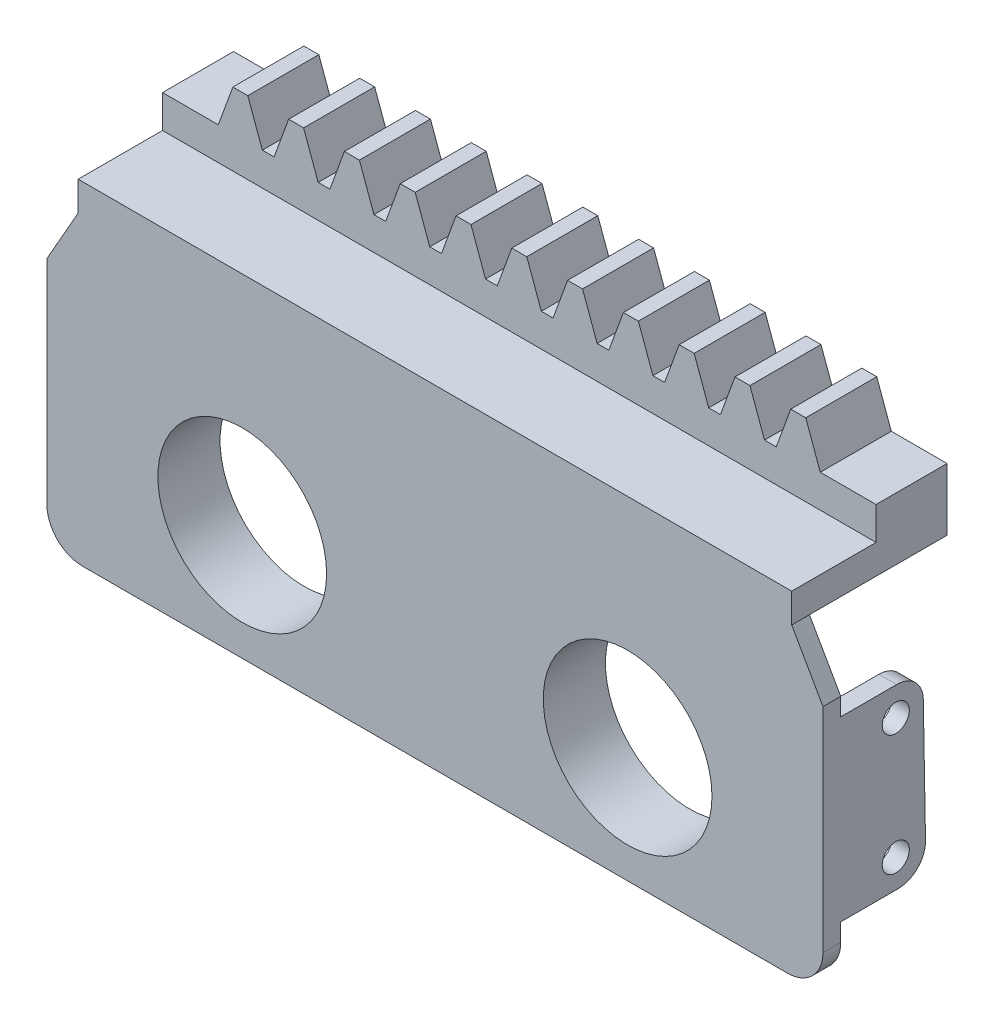
from build123d import *

# Parameters (mm, degrees)
SKETCH1_W           = 213.628300444
SKETCH1_H           = 8
EXTRUDE1_DEPTH      = 8
EXTRUDE2_DEPTH      = 8
LPATTERN1_COUNT     = 34
LPATTERN1_PITCH     = 6.283185307
SKETCH_1_W          = 133.268632933
SKETCH_1_H          = 8
CUT_EXTRUDE_1_DEPTH = 25
SKETCH_2_W          = 4.961443825
SKETCH_2_H          = 8
CUT_EXTRUDE_2_DEPTH = 50
SKETCH_3_W          = 80.359667511
SKETCH_3_H          = 1
CUT_EXTRUDE_3_DEPTH = 50
SKETCH_4_W          = 80.359667511
SKETCH_4_H          = 9.5
EXTRUDE_1_DEPTH     = 3.3
SKETCH_5_R          = 10.5
SKETCH_5_R_2        = 9.5
EXTRUDE_2_DEPTH     = 7
EXTRUDE_2_2_DEPTH   = 7
SKETCH_6_R          = 10.5
EXTRUDE_3_DEPTH     = 2
EXTRUDE_4_DEPTH     = 2
SKETCH_8_R          = 1.525
CUT_EXTRUDE_4_DEPTH = 2
FILLET_1_R          = 4


with BuildPart() as part:
    # Sketch1 → Extrude1 (new body)
    with BuildSketch(Plane.XY):
        with Locations((106.814150222, -4)):
            Rectangle(SKETCH1_W, SKETCH1_H)
    extrude(amount=EXTRUDE1_DEPTH)

    # Sketch2 → Extrude2 (add)
    with BuildSketch(Plane.XY.offset(8)):
        Polygon((0, 0), (1.637866054, 4.5), (3.323577771, 4.5), (4.961443825, 0), align=None)
    extrude2 = extrude(amount=-EXTRUDE2_DEPTH)

    # LPattern1: Extrude2 ×34
    with Locations(*[(i * LPATTERN1_PITCH, 0, 0) for i in range(1, LPATTERN1_COUNT)]):
        add(extrude2)

    # 草图1 → 切除-拉伸1 (cut, symmetric)
    with BuildSketch(Plane(origin=(0, 0, 0), x_dir=(1, 0, 0), z_dir=(0, 1, 0))):
        with Locations((146.993983978, -4)):
            Rectangle(SKETCH_1_W, SKETCH_1_H)
    extrude(amount=CUT_EXTRUDE_1_DEPTH, both=True, mode=Mode.SUBTRACT)

    # 草图2 → 切除-拉伸2 (cut)
    with BuildSketch(Plane(origin=(0, 0, 0), x_dir=(1, 0, 0), z_dir=(0, 1, 0))):
        with Locations((77.878945599, -4)):
            Rectangle(SKETCH_2_W, SKETCH_2_H)
        with Locations((2.480721912, -4)):
            Rectangle(SKETCH_2_W, SKETCH_2_H)
    extrude(amount=CUT_EXTRUDE_2_DEPTH, mode=Mode.SUBTRACT)

    # 草图3 → 切除-拉伸3 (cut)
    with BuildSketch(Plane(origin=(0, 0, 0), x_dir=(-1, 0, 0), z_dir=(0, 0, -1))):
        with Locations((-40.179833756, -7.5)):
            Rectangle(SKETCH_3_W, SKETCH_3_H)
    extrude(amount=-CUT_EXTRUDE_3_DEPTH, mode=Mode.SUBTRACT)

    # 草图4 → 凸台-拉伸1 (add)
    with BuildSketch(Plane.XZ.offset(7)):
        with Locations((40.179833756, 12.75)):
            Rectangle(SKETCH_4_W, SKETCH_4_H)
    extrude(amount=-EXTRUDE_1_DEPTH)



with BuildPart() as body_2:
    # 草图5 → 凸台-拉伸2 (new body)
    with BuildSketch(Plane.XY.offset(17.5)):
        with Locations((61.879833756, -28.2)):
            Circle(SKETCH_5_R)
        with Locations((61.879833756, -28.2)):
            Circle(SKETCH_5_R_2, mode=Mode.SUBTRACT)
    extrude(amount=-EXTRUDE_2_DEPTH)


with BuildPart() as body_3:
    # 草图5 → Extrude 2 2 (new body)
    with BuildSketch(Plane.XY.offset(17.5)):
        with Locations((18.479833756, -28.2)):
            Circle(SKETCH_5_R)
        with Locations((18.479833756, -28.2)):
            Circle(SKETCH_5_R_2, mode=Mode.SUBTRACT)
    extrude(amount=-EXTRUDE_2_2_DEPTH)


with BuildPart() as part_1:
    add(part.part)

    add(body_2.part)  # 凸台-拉伸3 merges body 2

    add(body_3.part)  # 凸台-拉伸3 merges body 3
    # 草图6 → 凸台-拉伸3 (add)
    with BuildSketch(Plane.XY.offset(17.5)):
        Polygon((-3.520166244, -41.2), (83.879833756, -41.2), (83.879833756, -13.2), (80.359667511, -7), (0, -7), (-3.520166244, -13.2), align=None)
        with Locations((61.879833756, -28.2)):
            Circle(SKETCH_6_R, mode=Mode.SUBTRACT)
        with Locations((18.479833756, -28.2)):
            Circle(SKETCH_6_R, mode=Mode.SUBTRACT)
    extrude(amount=-EXTRUDE_3_DEPTH)

    # 草图7 → 凸台-拉伸4 (add)
    with BuildSketch(Plane.ZY.offset(3.520166244)):
        with BuildLine():
            Line((17.5, -15.2), (9.198571137, -15.2))
            ThreePointArc((9.198571137, -15.2), (7.09630212, -16.059797912), (6.199050778, -18.14635668))
            Line((6.199050778, -18.14635668), (5.950495627, -32.044568569))
            ThreePointArc((5.950495627, -32.044568569), (6.693951707, -34.11470505), (8.623569492, -35.170530414))
            ThreePointArc((8.623569492, -35.170530414), (8.836276209, -35.192623828), (9.05, -35.2))
            Line((9.05, -35.2), (17.5, -35.2))
            Line((17.5, -35.2), (17.5, -15.2))
        make_face()
    extrude_4 = extrude(amount=-EXTRUDE_4_DEPTH)

    # 镜向1: 凸台-拉伸4 across plane
    add(extrude_4.mirror(Plane.ZY.offset(-40.179833756)))

    # 草图8 → 切除-拉伸4 (cut)
    with BuildSketch(Plane.ZY.offset(3.520166244)):
        with Locations((9.3, -18.4)):
            Circle(SKETCH_8_R)
        with Locations((9.3, -32)):
            Circle(SKETCH_8_R)
    cut_extrude_4 = extrude(amount=-CUT_EXTRUDE_4_DEPTH, mode=Mode.SUBTRACT)

    # 镜向2: 切除-拉伸4 across plane
    add(cut_extrude_4.mirror(Plane.ZY.offset(-40.179833756)), mode=Mode.SUBTRACT)

    # 圆角1
    fillet_1_edges = [part_1.edges().sort_by_distance(p)[0] for p in [
        (83.879833756, -41.2, 16.5),
        (-3.520166244, -41.2, 16.5),
    ]]
    fillet(fillet_1_edges, radius=FILLET_1_R)


solid = part_1.part
